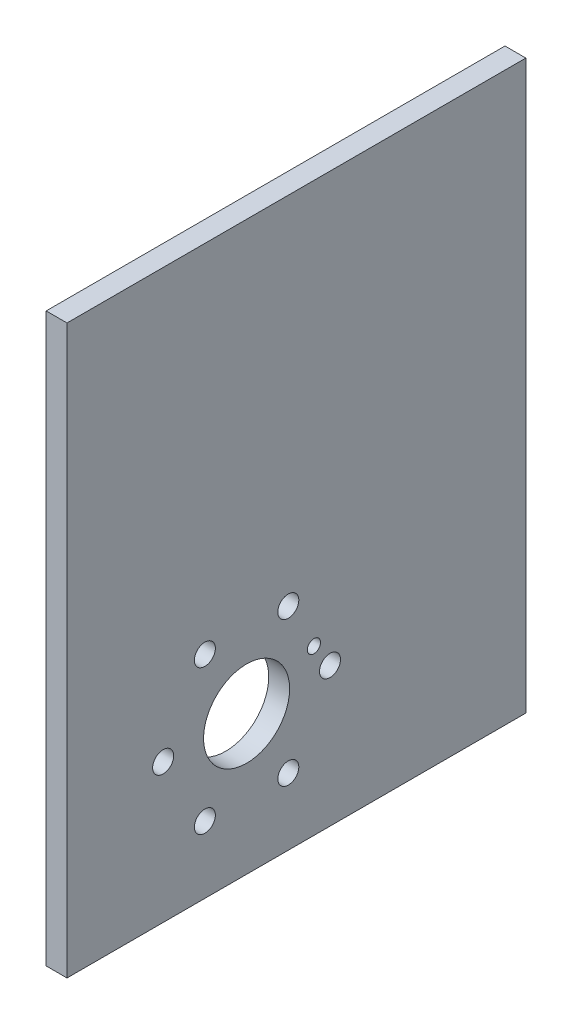
from build123d import *

# Parameters (mm, degrees)
SKETCH1_W                           = 69.85
SKETCH1_H                           = 86.36
BOSS_EXTRUDE1_DEPTH                 = 3.175
F_1_2_CLEARANCE_HOLE1_D             = 13.09624
F_1_2_CLEARANCE_HOLE1_DEPTH         = 25.4
F_1_2_CLEARANCE_HOLE1_TIP           = 3.934507437
M3_CLEARANCE_HOLE1_D                = 3.2
M3_CLEARANCE_HOLE1_DEPTH            = 25.4
M3_CLEARANCE_HOLE1_TIP              = 0.96137699
F_2_0MM_CLEARANCE_DOWEL_HOLE1_D     = 2
F_2_0MM_CLEARANCE_DOWEL_HOLE1_DEPTH = 25.4
F_2_0MM_CLEARANCE_DOWEL_HOLE1_TIP   = 0.600860619


with BuildPart() as part:
    # Sketch1 → Boss-Extrude1 (new body)
    with BuildSketch(Plane(origin=(0, 0, 0), x_dir=(0, 0, -1), z_dir=(1, 0, 0))):
        with Locations((34.925, 43.18)):
            Rectangle(SKETCH1_W, SKETCH1_H)
    extrude(amount=BOSS_EXTRUDE1_DEPTH)

    # 1/2 Clearance Hole1
    with Locations(Plane(origin=(3.175, 0, 0), x_dir=(0, 0, -1), z_dir=(1, 0, 0))):
        with Locations((27.33778886, 21.18693756)):
            Hole(F_1_2_CLEARANCE_HOLE1_D / 2, depth=F_1_2_CLEARANCE_HOLE1_DEPTH)
            with Locations((0, 0, -(F_1_2_CLEARANCE_HOLE1_DEPTH + F_1_2_CLEARANCE_HOLE1_TIP / 2))):  # 118° drill point
                Cone(0, F_1_2_CLEARANCE_HOLE1_D / 2, F_1_2_CLEARANCE_HOLE1_TIP, mode=Mode.SUBTRACT)

    # M3 Clearance Hole1
    with Locations(Plane.ZY):
        with Locations((-40.03778886, 21.18693756), (-33.68778886, 32.185460188), (-20.98778886, 32.185460188), (-14.63778886, 21.18693756), (-20.98778886, 10.188414932), (-33.68778886, 10.188414932), (-27.33778886, 21.18693756)):
            Hole(M3_CLEARANCE_HOLE1_D / 2, depth=M3_CLEARANCE_HOLE1_DEPTH)
            with Locations((0, 0, -(M3_CLEARANCE_HOLE1_DEPTH + M3_CLEARANCE_HOLE1_TIP / 2))):  # 118° drill point
                Cone(0, M3_CLEARANCE_HOLE1_D / 2, M3_CLEARANCE_HOLE1_TIP, mode=Mode.SUBTRACT)

    # Ø2.0mm Clearance Dowel Hole1
    with Locations(Plane(origin=(3.175, 0, 0), x_dir=(0, 0, -1), z_dir=(1, 0, 0))):
        with Locations((37.59058776, 24.95127344)):
            Hole(F_2_0MM_CLEARANCE_DOWEL_HOLE1_D / 2, depth=F_2_0MM_CLEARANCE_DOWEL_HOLE1_DEPTH)
            with Locations((0, 0, -(F_2_0MM_CLEARANCE_DOWEL_HOLE1_DEPTH + F_2_0MM_CLEARANCE_DOWEL_HOLE1_TIP / 2))):  # 118° drill point
                Cone(0, F_2_0MM_CLEARANCE_DOWEL_HOLE1_D / 2, F_2_0MM_CLEARANCE_DOWEL_HOLE1_TIP, mode=Mode.SUBTRACT)


solid = part.part
